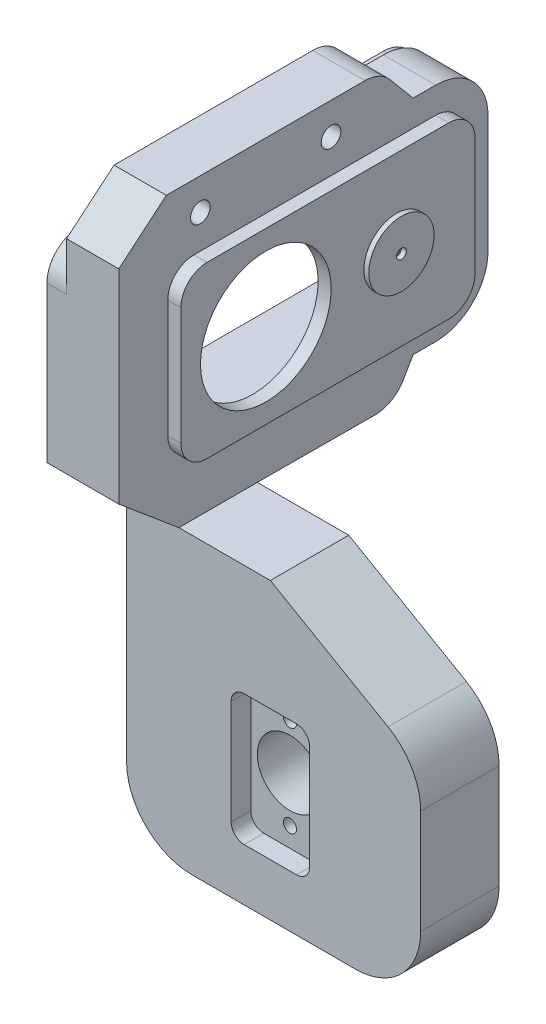
from build123d import *

# Parameters (mm, degrees)
BOSS_EXTRUDE1_DEPTH     = 12
SKETCH1_3_R             = 1.0000000000000018
SKETCH1_3_R_2           = 4.999999999999997
CUT_EXTRUDE1_DEPTH      = 3
SKETCH1_4_R             = 1.0000000000000018
SKETCH1_4_R_2           = 4.999999999999997
CUT_EXTRUDE2_DEPTH      = 65.76109943476871
BOSS_EXTRUDE2_DEPTH     = 8
BOSS_EXTRUDE3_DEPTH     = 10
CUT_EXTRUDE5_DEPTH      = 8
SKETCH3_7_R             = 10.000000000000016
CUT_EXTRUDE6_DEPTH      = 112.18901206469407
SKETCH7_R               = 1.2803794551692569
SKETCH7_R_2             = 1.2803794551692533
CUT_EXTRUDE7_DEPTH      = 3
CUT_EXTRUDE8_DEPTH      = 109.19887431911056
CUT_EXTRUDE8_DEPTH_BACK = 109.19887431911056
SKETCH9_R               = 1.5000000000000018
SKETCH9_R_2             = 1.5000000000000009
SKETCH12_R              = 0.49999999999999917
CUT_EXTRUDE9_DEPTH      = 10
SKETCH13_R              = 4.999999999999998
SKETCH13_R_2            = 0.7499999999999987
BOSS_EXTRUDE5_DEPTH     = 0.75
BOSS_EXTRUDE7_START     = 3
SKETCH14_R              = 1.2803794551692569
SKETCH14_R_2            = 1.2803794551692533
BOSS_EXTRUDE7_DEPTH     = 3
FILLET1_R               = 5
BOSS_EXTRUDE9_START     = -1
SKETCH16_R              = 0.49999999999999917
BOSS_EXTRUDE9_DEPTH     = 1
SKETCH17_R              = 2.499999999999999
BOSS_EXTRUDE10_DEPTH    = 1.75


with BuildPart() as part:
    # Sketch1 → Boss-Extrude1 (new body)
    with BuildSketch(Plane.XY):
        with BuildLine():
            Line((0, 45), (0, 10.00000000000007))
            ThreePointArc((0, 10.00000000000007), (2.9289321881345227, 2.9289321881345236), (10.000000000000071, 0))
            Line((10.000000000000071, 0), (34.99999999999999, 0))
            ThreePointArc((34.99999999999999, 0), (42.07106781186547, 2.9289321881345254), (45.00000000000001, 10))
            Line((45.00000000000001, 10), (45, 25.947441116742414))
            ThreePointArc((45, 25.947441116742414), (43.66025403784438, 30.947441116742425), (39.99999999999998, 34.60769515458682))
            Line((39.99999999999998, 34.60769515458682), (22.000000000000004, 45))
            Line((22.000000000000004, 45), (0, 45))
        make_face()
    extrude(amount=-BOSS_EXTRUDE1_DEPTH)

    # Sketch1<3> → Cut-Extrude1 (cut)
    # profile 1 of 4: a face of its own
    with BuildSketch(Plane.XY):
        with BuildLine():
            ThreePointArc((16, 25.999999999999996), (16.585786437626908, 27.414213562373092), (18.000000000000004, 27.999999999999996))
            Line((18.000000000000004, 27.999999999999996), (26.000000000000004, 27.999999999999996))
            ThreePointArc((26.000000000000004, 27.999999999999996), (27.4142135623731, 27.414213562373092), (28.000000000000007, 25.999999999999996))
            Line((28.000000000000007, 25.999999999999996), (28.000000000000007, 9.999999999999998))
            ThreePointArc((28.000000000000007, 9.999999999999998), (27.4142135623731, 8.585786437626904), (26.000000000000004, 7.999999999999998))
            Line((26.000000000000004, 7.999999999999998), (18.000000000000004, 7.999999999999998))
            ThreePointArc((18.000000000000004, 7.999999999999998), (16.585786437626908, 8.585786437626902), (16, 9.999999999999998))
            Line((16, 9.999999999999998), (16, 25.999999999999996))
        make_face()
        with Locations((22.000000000000004, 24.999999999999996)):
            Circle(SKETCH1_3_R, mode=Mode.SUBTRACT)
        with Locations((22.000000000000014, 11)):
            Circle(SKETCH1_3_R, mode=Mode.SUBTRACT)
    # profile 2 of 4: a face of its own
    with BuildSketch(Plane.XY):
        with Locations((22.000000000000004, 24.999999999999996)):
            Circle(SKETCH1_3_R)
    # profile 3 of 4: a face of its own
    with BuildSketch(Plane.XY):
        with Locations((22.000000000000014, 11)):
            Circle(SKETCH1_3_R)
    # profile 4 of 4: a face of its own
    with BuildSketch(Plane.XY):
        with Locations((22, 18)):
            Circle(SKETCH1_3_R_2)
    extrude(amount=-CUT_EXTRUDE1_DEPTH, mode=Mode.SUBTRACT)

    # Sketch1<4> → Cut-Extrude2 (cut, through all)
    with BuildSketch(Plane.XY):
        with Locations((22.000000000000004, 24.999999999999996)):
            Circle(SKETCH1_4_R)
        with Locations((22.000000000000014, 11)):
            Circle(SKETCH1_4_R)
        with Locations((22, 18)):
            Circle(SKETCH1_4_R_2)
    extrude(amount=-CUT_EXTRUDE2_DEPTH, mode=Mode.SUBTRACT)

    # Sketch3 → Boss-Extrude2 (add)
    with BuildSketch(Plane.ZY):
        with BuildLine():
            Line((0, 45), (9.192533317427756, 52.71345131623845))
            Line((9.192533317427756, 52.71345131623845), (9.192533317427753, 83.89351770797785))
            Line((9.192533317427753, 83.89351770797785), (1.9151111077974905, 90))
            Line((1.9151111077974914, 90), (-28.482631319534235, 90))
            ThreePointArc((-28.482631319534235, 90), (-30.595722628237752, 89.53153893518325), (-32.31285353512915, 88.21393804843267))
            Line((-32.31285353512915, 88.21393804843267), (-35.85089798717716, 83.99746086194635))
            Line((-35.85089798717716, 83.99746086194632), (-39.307466682572176, 83.99746086194632))
            ThreePointArc((-39.307466682572176, 83.99746086194632), (-44.9643209320646, 81.65431511143869), (-47.30746668257225, 75.99746086194627))
            Line((-47.30746668257224, 75.99746086194627), (-47.30746668257224, 57.99999999999996))
            ThreePointArc((-47.30746668257224, 57.99999999999996), (-44.96432093206462, 52.343145750507574), (-39.30746668257224, 49.99999999999996))
            Line((-39.30746668257224, 49.99999999999996), (-35.85089798717716, 49.99999999999996))
            Line((-35.85089798717716, 49.99999999999998), (-34.340222638150145, 47.408116516924004))
            ThreePointArc((-34.340222638150145, 47.408116516924004), (-32.50258227548949, 45.585533814191855), (-29.999847687039637, 44.92595107445804))
            Line((-29.999847687039637, 44.92595107445804), (-12, 45))
            Line((-12, 45), (0, 45))
        make_face()
        with BuildLine():
            ThreePointArc((-0.30746668257224474, 57.99999999999999), (-0.893253120199152, 56.585786437626886), (-2.3074666825722603, 55.99999999999998))
            Line((-2.3074666825722616, 55.99999999999998), (-39.307466682572226, 55.99999999999998))
            ThreePointArc((-39.307466682572226, 55.99999999999998), (-40.72168024494533, 56.585786437626886), (-41.30746668257224, 57.99999999999999))
            Line((-41.30746668257224, 57.99999999999999), (-41.30746668257225, 75.99999999999989))
            ThreePointArc((-41.30746668257225, 75.99999999999989), (-40.721680244945325, 77.41421356237302), (-39.30746668257219, 77.99999999999994))
            Line((-39.30746668257219, 77.99999999999994), (-2.307466682572233, 77.99999999999994))
            ThreePointArc((-2.307466682572236, 77.99999999999994), (-0.8932531201991549, 77.41421356237304), (-0.30746668257225007, 75.99999999999996))
            Line((-0.3074666825722463, 75.99999999999996), (-0.3074666825722459, 57.99999999999999))
        make_face(mode=Mode.SUBTRACT)
    extrude(amount=-BOSS_EXTRUDE2_DEPTH)

    # Sketch3<4> → Boss-Extrude3 (add)
    with BuildSketch(Plane.ZY):
        with BuildLine():
            Line((-43.307466682572255, 75.99746086194627), (-43.30746668257225, 57.99999999999996))
            ThreePointArc((-43.30746668257225, 57.99999999999996), (-42.13589380731844, 55.171572875253766), (-39.30746668257225, 53.99999999999995))
            Line((-39.30746668257225, 53.99999999999995), (-2.307466682572236, 53.99999999999995))
            ThreePointArc((-2.307466682572236, 53.99999999999995), (0.520960442173954, 55.17157287525376), (1.6925333174277633, 57.99999999999995))
            Line((1.6925333174277633, 57.99999999999995), (1.6925333174277606, 75.99746086194632))
            ThreePointArc((1.6925333174277606, 75.99746086194632), (0.5209604421739544, 78.8258879866925), (-2.307466682572236, 79.99746086194632))
            Line((-2.307466682572236, 79.99746086194632), (-39.30746668257218, 79.99746086194632))
            ThreePointArc((-39.30746668257218, 79.99746086194632), (-42.135893807318425, 78.8258879866925), (-43.307466682572255, 75.99746086194627))
        make_face()
    extrude(amount=-BOSS_EXTRUDE3_DEPTH)

    # Sketch3<6> → Cut-Extrude5 (cut)
    with BuildSketch(Plane.ZY):
        with BuildLine():
            Line((-41.30746668257225, 75.99999999999989), (-41.30746668257224, 57.99999999999999))
            ThreePointArc((-41.30746668257224, 57.99999999999999), (-40.72168024494533, 56.585786437626886), (-39.307466682572226, 55.99999999999998))
            Line((-39.307466682572226, 55.99999999999998), (-2.3074666825722603, 55.99999999999998))
            ThreePointArc((-2.3074666825722603, 55.99999999999998), (-0.8932531201991509, 56.585786437626886), (-0.3074666825722459, 57.99999999999999))
            Line((-0.3074666825722459, 57.99999999999999), (-0.3074666825722463, 75.99999999999996))
            ThreePointArc((-0.3074666825722463, 75.99999999999996), (-0.8932531201991507, 77.41421356237304), (-2.307466682572236, 77.99999999999994))
            Line((-2.307466682572236, 77.99999999999994), (-39.30746668257219, 77.99999999999994))
            ThreePointArc((-39.30746668257219, 77.99999999999994), (-40.721680244945325, 77.41421356237302), (-41.30746668257225, 75.99999999999989))
        make_face()
    extrude(amount=-CUT_EXTRUDE5_DEPTH, mode=Mode.SUBTRACT)

    # Sketch3<7> → Cut-Extrude6 (cut, through all)
    with BuildSketch(Plane.ZY):
        with Locations((-11.307466682572244, 66.99999999999991)):
            Circle(SKETCH3_7_R)
    extrude(amount=-CUT_EXTRUDE6_DEPTH, mode=Mode.SUBTRACT)

    # Sketch7 → Cut-Extrude7 (cut)
    with BuildSketch(Plane.ZY):
        with Locations((-44.30746668257226, 71.99999999999999)):
            Circle(SKETCH7_R)
        with Locations((-44.307466682572255, 61.99999999999998)):
            Circle(SKETCH7_R)
        with Locations((2.692533317427754, 61.99999999999998)):
            Circle(SKETCH7_R_2)
        with Locations((2.692533317427754, 71.99999999999999)):
            Circle(SKETCH7_R_2)
    extrude(amount=-CUT_EXTRUDE7_DEPTH, mode=Mode.SUBTRACT)

    # Sketch9 → Cut-Extrude8 (cut, two sides: drawn at the far end of the back side and taken through both)
    with BuildSketch(Plane(origin=(8, 0, 0), x_dir=(0, 0, -1), z_dir=(1, 0, 0)).offset(-CUT_EXTRUDE8_DEPTH_BACK)):
        with Locations((3.283760105868373, 85.14746086194633)):
            Circle(SKETCH9_R)
        with Locations((23.28376010586837, 85.14746086194633)):
            Circle(SKETCH9_R_2)
    extrude(amount=CUT_EXTRUDE8_DEPTH + CUT_EXTRUDE8_DEPTH_BACK, mode=Mode.SUBTRACT)

    # Sketch12 → Cut-Extrude9 (cut)
    with BuildSketch(Plane(origin=(10, 0, 0), x_dir=(0, 0, -1), z_dir=(1, 0, 0))):
        with Locations((31.30746668257224, 66.99999999999997)):
            Circle(SKETCH12_R)
    extrude(amount=-CUT_EXTRUDE9_DEPTH, mode=Mode.SUBTRACT)

    # Sketch13 → Boss-Extrude5 (add)
    with BuildSketch(Plane(origin=(10, 0, 0), x_dir=(0, 0, -1), z_dir=(1, 0, 0))):
        with Locations((31.30746668257224, 66.99999999999991)):
            Circle(SKETCH13_R)
        with Locations((31.30746668257224, 66.99999999999991)):
            Circle(SKETCH13_R_2, mode=Mode.SUBTRACT)
    extrude(amount=BOSS_EXTRUDE5_DEPTH)

    # Sketch14 → Boss-Extrude7 (add)
    with BuildSketch(Plane.ZY.offset(BOSS_EXTRUDE7_START)):
        with BuildLine():
            Line((-35.85089798717716, 49.99999999999997), (5.958767962971046, 49.99999999999997))
            Line((5.958767962971046, 49.99999999999997), (9.192533317427753, 52.71345131623845))
            Line((9.192533317427753, 52.71345131623845), (9.192533317427753, 81.49999999999994))
            Line((9.192533317427753, 81.49999999999994), (-45.11453677291794, 81.49999999999994))
            ThreePointArc((-45.11453677291794, 81.49999999999994), (-46.739039891616386, 78.95916976705784), (-47.30746668257223, 75.99746086194627))
            Line((-47.30746668257223, 75.99746086194627), (-47.30746668257224, 57.99999999999996))
            ThreePointArc((-47.30746668257224, 57.99999999999996), (-44.96432093206462, 52.343145750507574), (-39.30746668257224, 49.99999999999996))
            Line((-39.30746668257224, 49.99999999999996), (-35.85089798717716, 49.99999999999997))
        make_face()
        with Locations((-44.30746668257226, 71.99999999999999)):
            Circle(SKETCH14_R, mode=Mode.SUBTRACT)
        with Locations((-44.307466682572255, 61.99999999999998)):
            Circle(SKETCH14_R, mode=Mode.SUBTRACT)
        with Locations((2.692533317427754, 61.99999999999998)):
            Circle(SKETCH14_R_2, mode=Mode.SUBTRACT)
        with Locations((2.692533317427754, 71.99999999999999)):
            Circle(SKETCH14_R_2, mode=Mode.SUBTRACT)
        with BuildLine():
            Line((-0.3074666825722463, 75.99999999999996), (-0.3074666825722459, 57.99999999999999))
            ThreePointArc((-0.3074666825722459, 57.99999999999999), (-0.8932531201991509, 56.585786437626886), (-2.3074666825722603, 55.99999999999998))
            Line((-2.3074666825722603, 55.99999999999998), (-39.307466682572226, 55.99999999999998))
            ThreePointArc((-39.307466682572226, 55.99999999999998), (-40.72168024494533, 56.585786437626886), (-41.30746668257224, 57.99999999999999))
            Line((-41.30746668257224, 57.99999999999999), (-41.30746668257225, 75.99999999999989))
            ThreePointArc((-41.30746668257225, 75.99999999999989), (-40.721680244945325, 77.41421356237302), (-39.30746668257219, 77.99999999999994))
            Line((-39.30746668257219, 77.99999999999994), (-2.307466682572236, 77.99999999999994))
            ThreePointArc((-2.307466682572236, 77.99999999999994), (-0.893253120199148, 77.41421356237305), (-0.3074666825722463, 75.99999999999996))
        make_face(mode=Mode.SUBTRACT)
    extrude(amount=-BOSS_EXTRUDE7_DEPTH)

    # Fillet1
    fillet1_edges = [part.edges().sort_by_distance(p)[0] for p in [
        (-1.5, 81.49999999999994, 9.192533317427753),
        (-1.5, 81.49999999999994, -45.11453677291794),
    ]]
    fillet(fillet1_edges, radius=FILLET1_R)

    # Sketch16 → Boss-Extrude9 (add)
    with BuildSketch(Plane.ZY.offset(-8).offset(BOSS_EXTRUDE9_START)):
        with Locations(Location((-31.30746668257224, 66.99999999999997, 0), (0, 0, 180))):
            Circle(SKETCH16_R)
    extrude(amount=BOSS_EXTRUDE9_DEPTH)

    # Sketch17 → Boss-Extrude10 (add)
    with BuildSketch(Plane.ZY.offset(-8)):
        with Locations((-31.30746668257224, 66.99999999999997)):
            Circle(SKETCH17_R)
    extrude(amount=BOSS_EXTRUDE10_DEPTH)


solid = part.part
